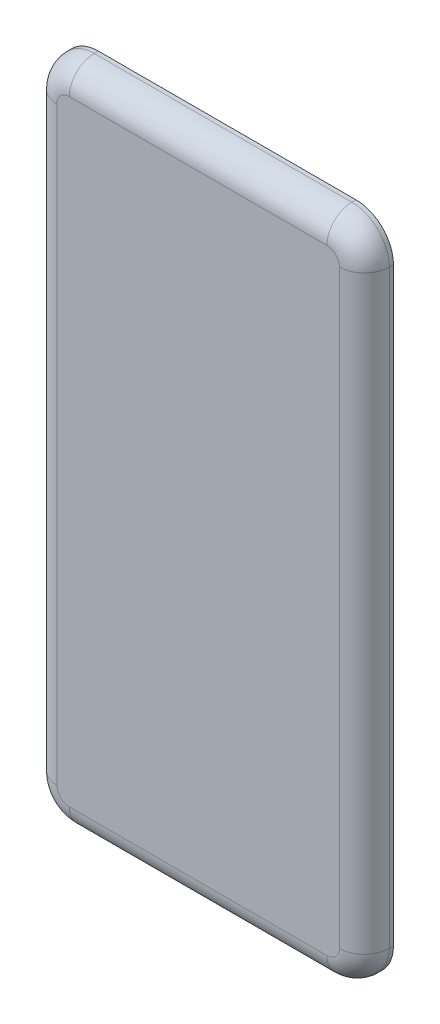
from build123d import *

# Parameters (mm, degrees)
SKETCH_1_W      = 40
SKETCH_1_H      = 80
EXTRUDE_1_DEPTH = 3.5
FILLET_1_R      = 4.5
FILLET_2_R      = 3


with BuildPart() as part:
    # 草图1 → 凸台-拉伸1 (new body)
    with BuildSketch(Plane.XY):
        with Locations((68.192883988, 40)):
            Rectangle(SKETCH_1_W, SKETCH_1_H)
    extrude(amount=EXTRUDE_1_DEPTH)

    # 圆角1
    fillet_1_edges = [part.edges().sort_by_distance(p)[0] for p in [
        (48.192883988, 0, 1.75),
        (48.192883988, 80, 1.75),
        (88.192883988, 80, 1.75),
        (88.192883988, 0, 1.75),
    ]]
    fillet(fillet_1_edges, radius=FILLET_1_R)

    # 圆角2
    fillet_2_edges = [part.edges().sort_by_distance(p)[0] for p in [
        (68.192883988, 0, 3.5),
        (48.192883988, 40, 3.5),
        (88.192883988, 40, 3.5),
        (68.192883988, 80, 3.5),
        (86.874864503, 78.681980515, 3.5),
        (49.510903472, 78.681980515, 3.5),
        (86.874864503, 1.318019485, 3.5),
        (49.510903472, 1.318019485, 3.5),
    ]]
    fillet(fillet_2_edges, radius=FILLET_2_R)


solid = part.part
